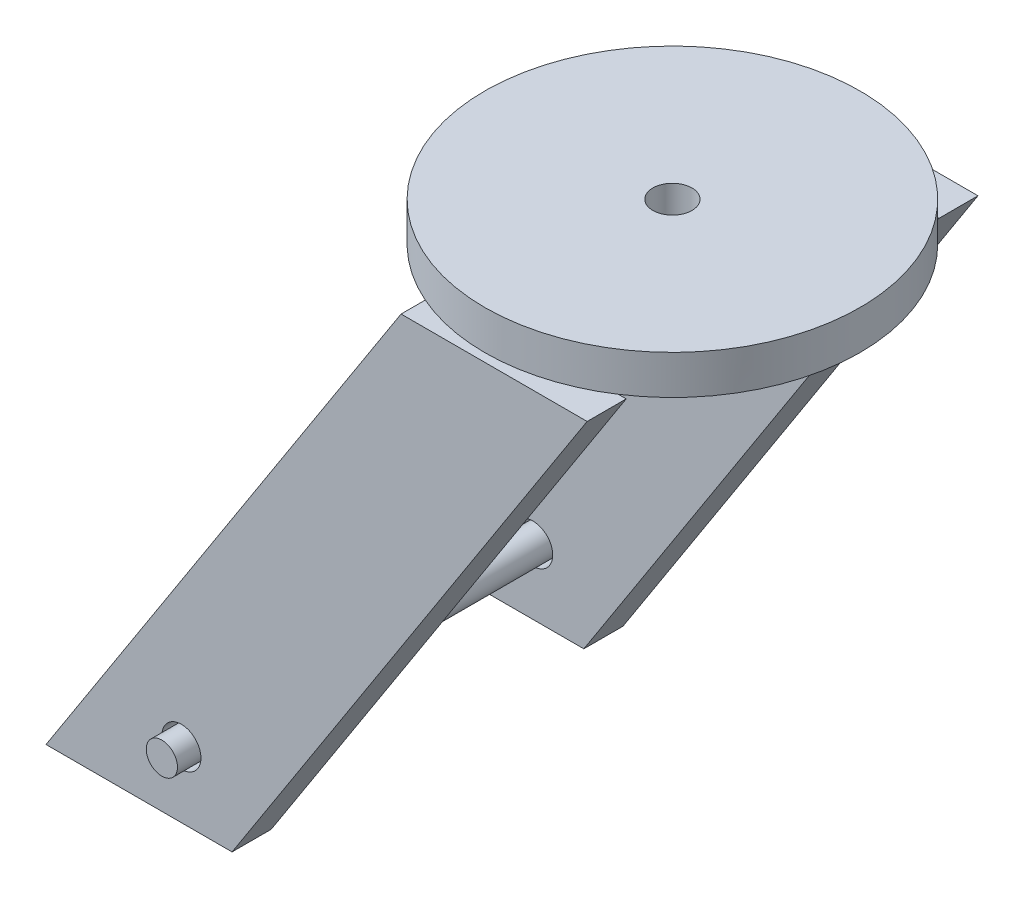
from build123d import *

# Parameters (mm, degrees)
BOSS_EXTRUDE1_START      = 40
SKETCH1_R                = 5
BOSS_EXTRUDE1_DEPTH      = 10
SKETCH2_R                = 48
SKETCH2_R_2              = 5
BOSS_EXTRUDE2_DEPTH      = 10
BOSS_EXTRUDE3_DEPTH      = 5
BOSS_EXTRUDE3_DEPTH_BACK = 105
SKETCH3_R                = 4


with BuildPart() as part:
    # Sketch1 → Boss-Extrude1 (new body)
    with BuildSketch(Plane.XY.offset(BOSS_EXTRUDE1_START)):
        Polygon((0, 0), (90.842537396, 140.805932964), (138.44477416, 140.805932964), (47.602236763, 0), align=None)
        with Locations((34.643655778, 16.805932964)):
            Circle(SKETCH1_R, mode=Mode.SUBTRACT)
    extrude(amount=BOSS_EXTRUDE1_DEPTH)


with BuildPart() as body_2:
    # Mirror2: mirrored copy
    add(part.part.mirror(Plane.XY))


with BuildPart() as part_1:
    add(part.part)

    add(body_2.part)  # Boss-Extrude2 merges body 2
    # Sketch2 → Boss-Extrude2 (add)
    with BuildSketch(Plane(origin=(0, 140.805932964, 0), x_dir=(1, 0, 0), z_dir=(0, 1, 0))):
        with Locations(Location((110.118373537, 0.145746877, 0), (0, 0, 113.6769841))):
            Circle(SKETCH2_R)
        with Locations(Location((110.118373537, 0.145746877, 0), (0, 0, 270))):
            Circle(SKETCH2_R_2, mode=Mode.SUBTRACT)
    extrude(amount=BOSS_EXTRUDE2_DEPTH)


with BuildPart() as body_2_2:
    # Sketch3 → Boss-Extrude3 (new, two sides: drawn at the far end of the back side and taken through both)
    with BuildSketch(Plane.XY.offset(50).offset(-BOSS_EXTRUDE3_DEPTH_BACK)):
        with Locations((34.643655778, 16.805932964)):
            Circle(SKETCH3_R)
    extrude(amount=BOSS_EXTRUDE3_DEPTH + BOSS_EXTRUDE3_DEPTH_BACK)


solid = Compound([part_1.part, body_2_2.part])
